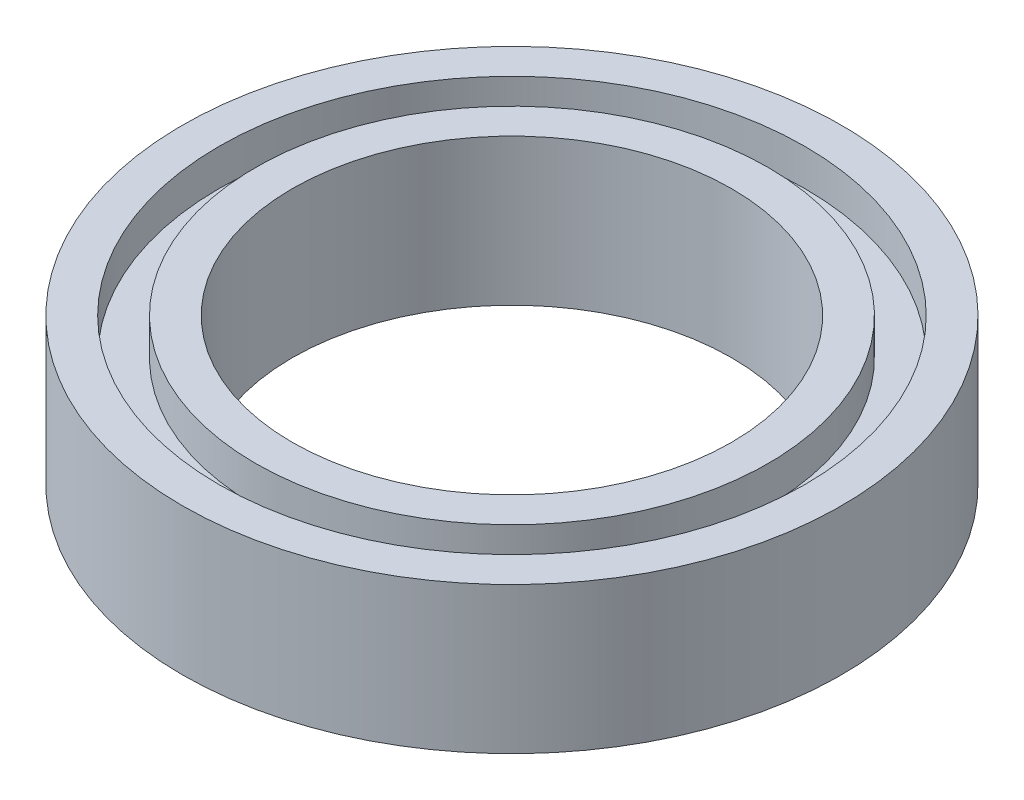
from build123d import *

# Parameters (mm, degrees)
SKETCH1_R           = 9
SKETCH1_R_2         = 6
BOSS_EXTRUDE1_DEPTH = 4
SKETCH2_R           = 8
SKETCH2_R_2         = 7
CUT_EXTRUDE1_DEPTH  = 1
CUT_EXTRUDE2_START  = -1
SKETCH3_R           = 8
SKETCH3_R_2         = 7
CUT_EXTRUDE2_DEPTH  = 1


with BuildPart() as part:
    # Sketch1 → Boss-Extrude1 (new body)
    with BuildSketch(Plane(origin=(0, 0, 0), x_dir=(1, 0, 0), z_dir=(0, 1, 0))):
        with Locations(Location((0, 0, 0), (0, 0, 270))):
            Circle(SKETCH1_R)
        with Locations(Location((0, 0, 0), (0, 0, 270))):
            Circle(SKETCH1_R_2, mode=Mode.SUBTRACT)
    extrude(amount=BOSS_EXTRUDE1_DEPTH)

    # Sketch2 → Cut-Extrude1 (cut)
    with BuildSketch(Plane(origin=(0, 4, 0), x_dir=(1, 0, 0), z_dir=(0, 1, 0))):
        with Locations(Location((0, 0, 0), (0, 0, 270))):
            Circle(SKETCH2_R)
        with Locations(Location((0, 0, 0), (0, 0, 270))):
            Circle(SKETCH2_R_2, mode=Mode.SUBTRACT)
    extrude(amount=-CUT_EXTRUDE1_DEPTH, mode=Mode.SUBTRACT)

    # Sketch3 → Cut-Extrude2 (cut)
    with BuildSketch(Plane.XZ.offset(CUT_EXTRUDE2_START)):
        with Locations(Location((0, 0, 0), (0, 0, 90))):
            Circle(SKETCH3_R)
        with Locations(Location((0, 0, 0), (0, 0, 90))):
            Circle(SKETCH3_R_2, mode=Mode.SUBTRACT)
    extrude(amount=CUT_EXTRUDE2_DEPTH, mode=Mode.SUBTRACT)


solid = part.part
